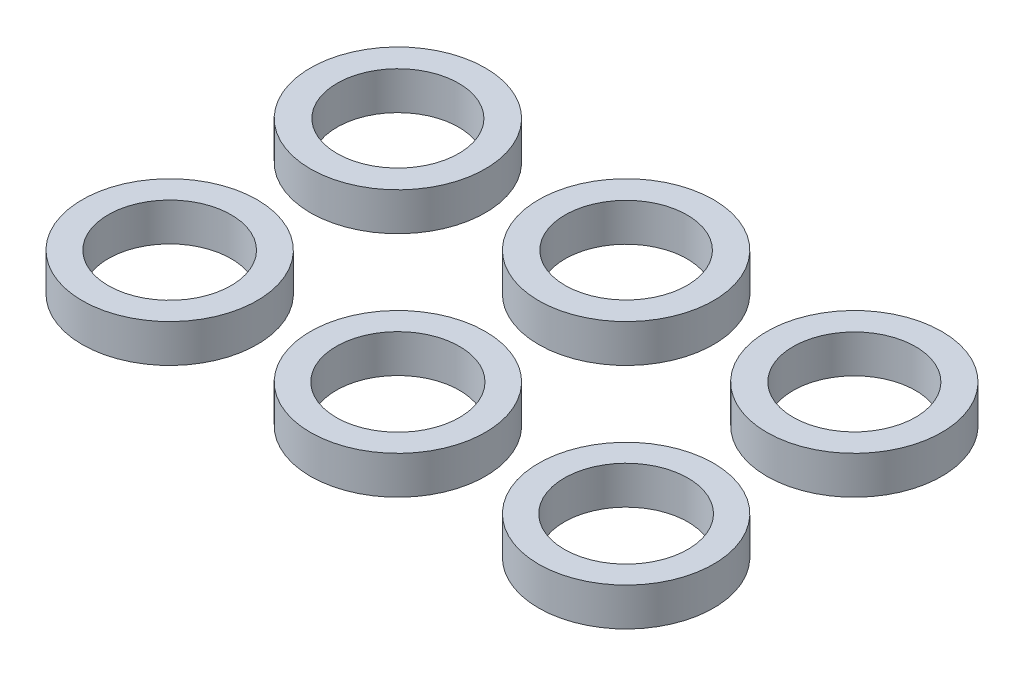
from build123d import *

# Parameters (mm, degrees)
SKETCH1_R             = 11.5
SKETCH1_R_2           = 8
BOSS_EXTRUDE1_DEPTH   = 5
SKETCH1_R_3           = 8.025
BOSS_EXTRUDE1_2_DEPTH = 5
SKETCH1_R_4           = 8.05
BOSS_EXTRUDE1_3_DEPTH = 5
SKETCH1_R_5           = 8.1
BOSS_EXTRUDE1_4_DEPTH = 5
SKETCH1_R_6           = 8.125
BOSS_EXTRUDE1_5_DEPTH = 5
SKETCH1_R_7           = 8.075
BOSS_EXTRUDE1_6_DEPTH = 5


with BuildPart() as part:
    # Sketch1 → Boss-Extrude1 (new body)
    with BuildSketch(Plane(origin=(0, 0, 0), x_dir=(1, 0, 0), z_dir=(0, 1, 0))):
        with Locations(Location((0, 0, 0), (0, 0, 270))):
            Circle(SKETCH1_R)
        with Locations(Location((0, 0, 0), (0, 0, 270))):
            Circle(SKETCH1_R_2, mode=Mode.SUBTRACT)
    extrude(amount=BOSS_EXTRUDE1_DEPTH)


with BuildPart() as body_2:
    # Sketch1 → Boss-Extrude1 2 (new body)
    with BuildSketch(Plane(origin=(0, 0, 0), x_dir=(1, 0, 0), z_dir=(0, 1, 0))):
        with Locations(Location((30, 0, 0), (0, 0, 270))):
            Circle(SKETCH1_R)
        with Locations(Location((30, 0, 0), (0, 0, 270))):
            Circle(SKETCH1_R_3, mode=Mode.SUBTRACT)
    extrude(amount=BOSS_EXTRUDE1_2_DEPTH)


with BuildPart() as body_3:
    # Sketch1 → Boss-Extrude1 3 (new body)
    with BuildSketch(Plane(origin=(0, 0, 0), x_dir=(1, 0, 0), z_dir=(0, 1, 0))):
        with Locations(Location((60, 0, 0), (0, 0, 270))):
            Circle(SKETCH1_R)
        with Locations(Location((60, 0, 0), (0, 0, 270))):
            Circle(SKETCH1_R_4, mode=Mode.SUBTRACT)
    extrude(amount=BOSS_EXTRUDE1_3_DEPTH)


with BuildPart() as body_4:
    # Sketch1 → Boss-Extrude1 4 (new body)
    with BuildSketch(Plane(origin=(0, 0, 0), x_dir=(1, 0, 0), z_dir=(0, 1, 0))):
        with Locations(Location((30, -30, 0), (0, 0, 270))):
            Circle(SKETCH1_R)
        with Locations(Location((30, -30, 0), (0, 0, 270))):
            Circle(SKETCH1_R_5, mode=Mode.SUBTRACT)
    extrude(amount=BOSS_EXTRUDE1_4_DEPTH)


with BuildPart() as body_5:
    # Sketch1 → Boss-Extrude1 5 (new body)
    with BuildSketch(Plane(origin=(0, 0, 0), x_dir=(1, 0, 0), z_dir=(0, 1, 0))):
        with Locations(Location((60, -30, 0), (0, 0, 270))):
            Circle(SKETCH1_R)
        with Locations(Location((60, -30, 0), (0, 0, 270))):
            Circle(SKETCH1_R_6, mode=Mode.SUBTRACT)
    extrude(amount=BOSS_EXTRUDE1_5_DEPTH)


with BuildPart() as body_6:
    # Sketch1 → Boss-Extrude1 6 (new body)
    with BuildSketch(Plane(origin=(0, 0, 0), x_dir=(1, 0, 0), z_dir=(0, 1, 0))):
        with Locations(Location((0, -30, 0), (0, 0, 270))):
            Circle(SKETCH1_R)
        with Locations(Location((0, -30, 0), (0, 0, 270))):
            Circle(SKETCH1_R_7, mode=Mode.SUBTRACT)
    extrude(amount=BOSS_EXTRUDE1_6_DEPTH)


solid = Compound([part.part, body_2.part, body_3.part, body_4.part, body_5.part, body_6.part])
